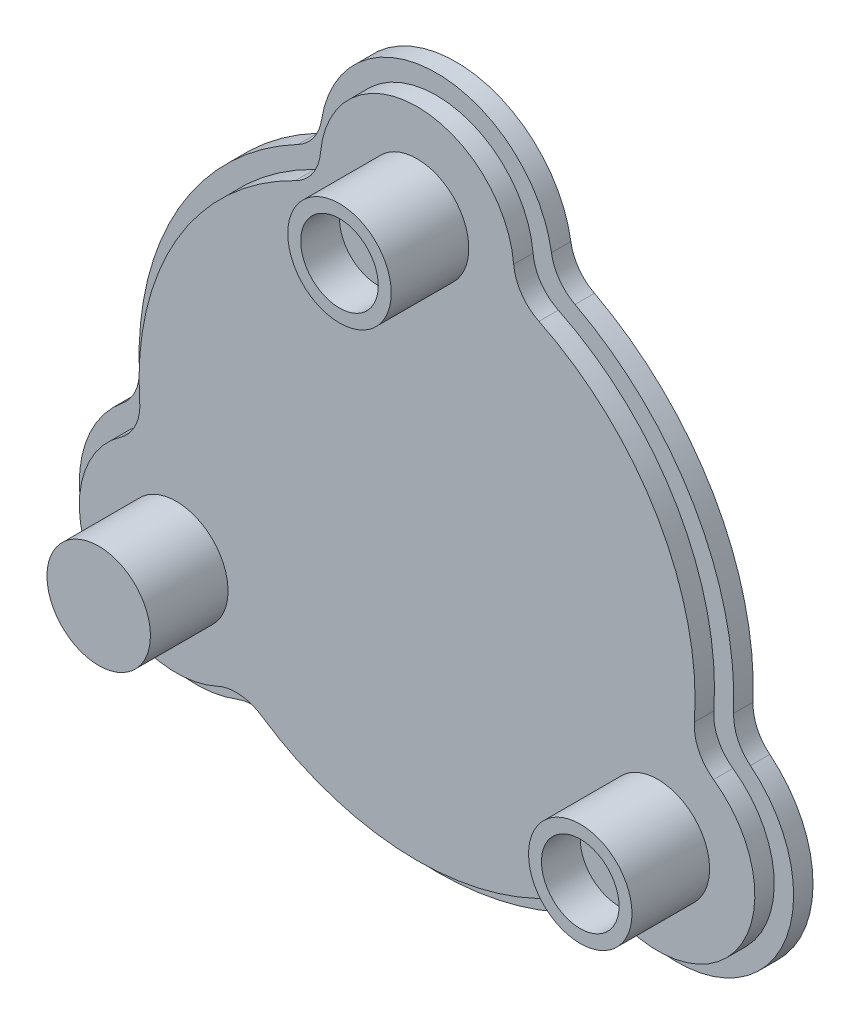
from build123d import *

# Parameters (mm, degrees)
BOSS_EXTRUDE5_DEPTH      = 6000
BOSS_EXTRUDE5_DEPTH_BACK = 1
BOSS_EXTRUDE6_DEPTH      = 3000
SKETCH1_10_R             = 6000
BOSS_EXTRUDE8_DEPTH      = 12000
SKETCH1_12_R             = 8000
SKETCH1_12_R_2           = 6000
BOSS_EXTRUDE9_DEPTH      = 18000


with BuildPart() as part:
    # Sketch1 → Boss-Extrude5 (new, two sides: drawn at the far end of the back side and taken through both)
    with BuildSketch(Plane.XY.offset(-BOSS_EXTRUDE5_DEPTH_BACK)):
        with BuildLine():
            ThreePointArc((-18846.153453689, 38650), (-37239.092362731, 21500), (-42894.958583113, -3003.752345485))
            ThreePointArc((-42894.958583113, -3003.752345485), (-43557.93463547, -6502.479183601), (-45856.433127396, -9222.319512806))
            ThreePointArc((-45856.433127396, -9222.319512806), (-50229.473419497, -29000), (-30914.979543605, -35101.676258865))
            ThreePointArc((-30914.979543605, -35101.676258865), (-27410.279478313, -34471.038338899), (-24048.805129424, -35646.247654515))
            ThreePointArc((-24048.805129424, -35646.247654515), (0, -43000), (24048.805129424, -35646.247654515))
            ThreePointArc((24048.805129424, -35646.247654515), (27410.279478313, -34471.038338899), (30914.979543605, -35101.676258865))
            ThreePointArc((30914.979543605, -35101.676258865), (50229.473419497, -29000), (45856.433127396, -9222.319512806))
            ThreePointArc((45856.433127396, -9222.319512806), (43557.93463547, -6502.479183601), (42894.958583113, -3003.752345485))
            ThreePointArc((42894.958583113, -3003.752345485), (37239.092362731, 21500), (18846.153453689, 38650))
            ThreePointArc((18846.153453689, 38650), (16147.655157157, 40973.5175225), (14941.453583792, 44323.99577167))
            ThreePointArc((14941.453583792, 44323.99577167), (0, 58000), (-14941.453583792, 44323.99577167))
            ThreePointArc((-14941.453583792, 44323.99577167), (-16147.655157157, 40973.5175225), (-18846.153453689, 38650))
        make_face()
    extrude(amount=BOSS_EXTRUDE5_DEPTH + BOSS_EXTRUDE5_DEPTH_BACK)

    # Sketch1<7> → Boss-Extrude6 (add)
    with BuildSketch(Plane.XY):
        with BuildLine():
            ThreePointArc((30777.913736812, -38300.39198245), (52827.549630851, -30500), (48558.06930011, -7504.259180341))
            ThreePointArc((48558.06930011, -7504.259180341), (46585.28150192, -4953.584458975), (45965.190727806, -1789.201318021))
            ThreePointArc((45965.190727806, -1789.201318021), (39837.168574084, 23000), (21433.101570013, 40701.623519087))
            ThreePointArc((21433.101570013, 40701.623519087), (19002.710769696, 42820.8294526), (17780.155563297, 45804.651162791))
            ThreePointArc((17780.155563297, 45804.651162791), (0, 61000), (-17780.155563297, 45804.651162791))
            ThreePointArc((-17780.155563297, 45804.651162791), (-19002.710769696, 42820.8294526), (-21433.101570013, 40701.623519087))
            ThreePointArc((-21433.101570013, 40701.623519087), (-39837.168574084, 23000), (-45965.190727806, -1789.201318021))
            ThreePointArc((-45965.190727806, -1789.201318021), (-46585.28150192, -4953.584458975), (-48558.06930011, -7504.259180341))
            ThreePointArc((-48558.06930011, -7504.259180341), (-52827.549630851, -30500), (-30777.913736812, -38300.39198245))
            ThreePointArc((-30777.913736812, -38300.39198245), (-27582.570732224, -37867.244993625), (-24532.089157793, -38912.422201067))
            ThreePointArc((-24532.089157793, -38912.422201067), (0, -46000), (24532.089157793, -38912.422201067))
            ThreePointArc((24532.089157793, -38912.422201067), (27582.570732224, -37867.244993625), (30777.913736812, -38300.39198245))
        make_face()
    extrude(amount=BOSS_EXTRUDE6_DEPTH)

    # Sketch1<10> → Boss-Extrude8 (add)
    with BuildSketch(Plane.XY):
        with Locations((0, 43000)):
            Circle(SKETCH1_10_R)
        with Locations((37239.092362731, -21500)):
            Circle(SKETCH1_10_R)
        with Locations((-37239.092362731, -21500)):
            Circle(SKETCH1_10_R)
    extrude(amount=BOSS_EXTRUDE8_DEPTH)

    # Sketch1<12> → Boss-Extrude9 (add)
    # profile 1 of 3: a face of its own
    with BuildSketch(Plane.XY):
        with Locations((-37239.092362731, -21500)):
            Circle(SKETCH1_12_R)
    # profile 2 of 3: a face of its own
    with BuildSketch(Plane.XY):
        with Locations((0, 43000)):
            Circle(SKETCH1_12_R)
        with Locations((0, 43000)):
            Circle(SKETCH1_12_R_2, mode=Mode.SUBTRACT)
    # profile 3 of 3: a face of its own
    with BuildSketch(Plane.XY):
        with Locations((37239.092362731, -21500)):
            Circle(SKETCH1_12_R)
        with Locations((37239.092362731, -21500)):
            Circle(SKETCH1_12_R_2, mode=Mode.SUBTRACT)
    extrude(amount=BOSS_EXTRUDE9_DEPTH)


solid = part.part
